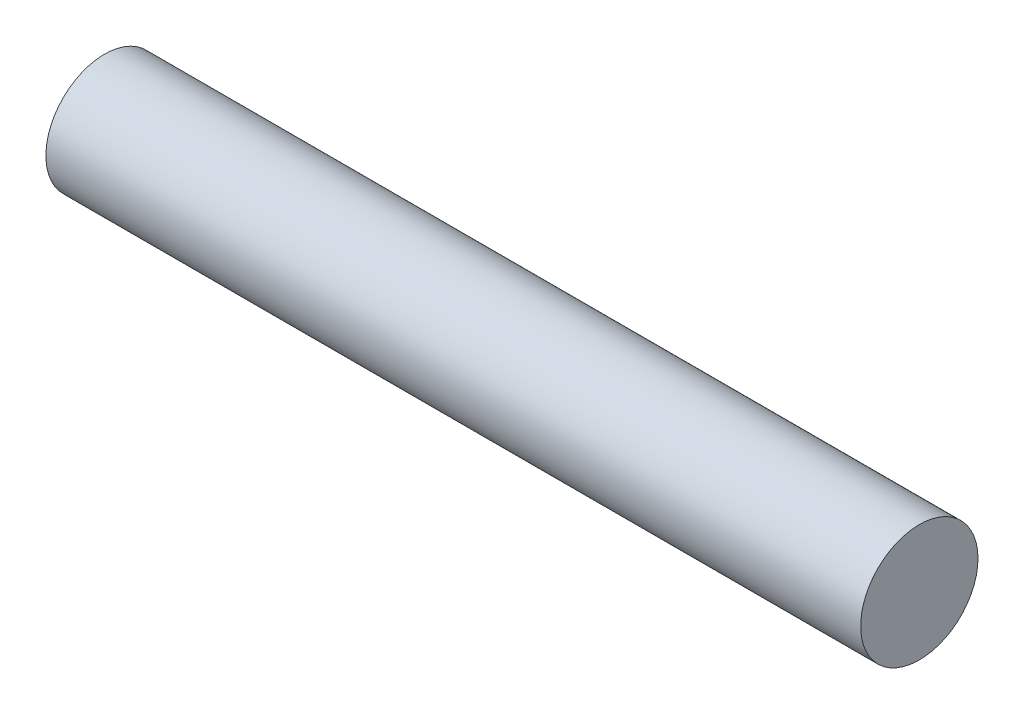
from build123d import *

# Parameters (mm, degrees)
SKETCH_5_R      = 1.8
EXTRUDE_1_DEPTH = 25


with BuildPart() as part:
    # 草图5 → 凸台-拉伸1 (new body)
    with BuildSketch(Plane(origin=(0, 0, 0), x_dir=(0, 0, -1), z_dir=(1, 0, 0))):
        Circle(SKETCH_5_R)
    extrude(amount=EXTRUDE_1_DEPTH)


solid = part.part
